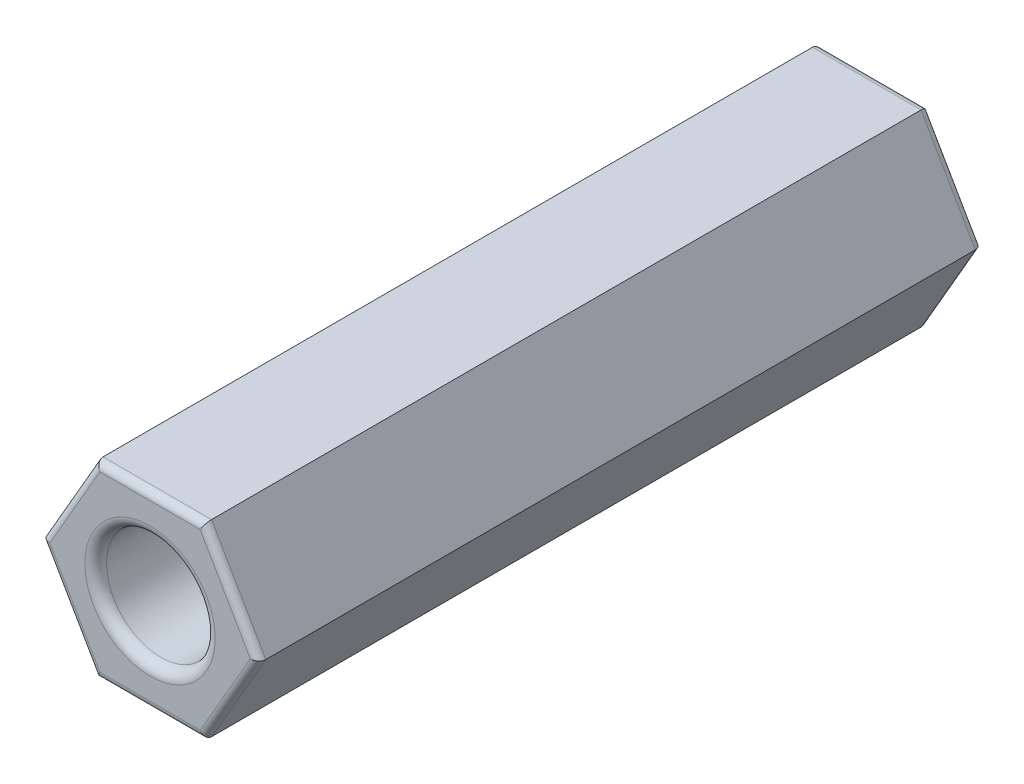
from build123d import *

# Parameters (mm, degrees)
SKETCH1_R           = 1.5
BOSS_EXTRUDE1_DEPTH = 20
FILLET1_R           = 0.3
FILLET2_R           = 0.2


with BuildPart() as part:
    # Sketch1 → Boss-Extrude1 (new body)
    with BuildSketch(Plane.XY):
        Polygon((3, 0), (1.5, 2.598076211), (-1.5, 2.598076211), (-3, 0), (-1.5, -2.598076211), (1.5, -2.598076211), align=None)
        Circle(SKETCH1_R, mode=Mode.SUBTRACT)
    extrude(amount=BOSS_EXTRUDE1_DEPTH)

    # Fillet1
    fillet1_edges = [part.edges().sort_by_distance(p)[0] for p in [
        (-1.5, 0, 0),
        (-1.5, 0, 20),
    ]]
    fillet(fillet1_edges, radius=FILLET1_R)

    # Fillet2
    fillet2_edges = [part.edges().sort_by_distance(p)[0] for p in [
        (0, 2.598076211, 20),
        (-2.25, 1.299038106, 20),
        (-2.25, -1.299038106, 20),
        (0, -2.598076211, 20),
        (2.25, -1.299038106, 20),
        (0, -2.598076211, 0),
        (-2.25, -1.299038106, 0),
        (-2.25, 1.299038106, 0),
        (2.25, 1.299038106, 20),
        (0, 2.598076211, 0),
        (2.25, 1.299038106, 0),
        (2.25, -1.299038106, 0),
    ]]
    fillet(fillet2_edges, radius=FILLET2_R)


solid = part.part
